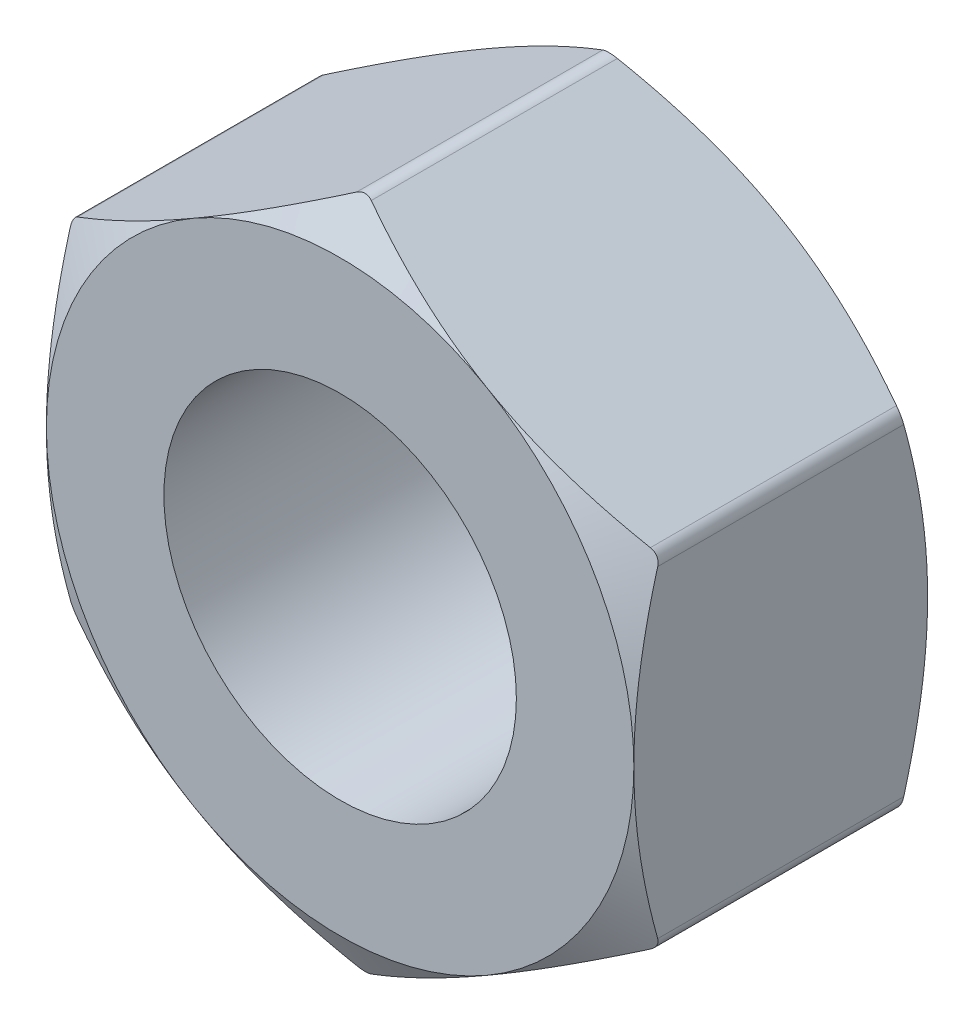
from build123d import *

# Parameters (mm, degrees)
BOSS_EXTRUDE2_DEPTH     = 2.5
CUT_EXTRUDE4_DEPTH      = 9.036375634
CUT_EXTRUDE4_DEPTH_BACK = 9.036375634
SKETCH16_R              = 3
SKETCH7_OUTSIDE_W       = 50.302
SKETCH7_OUTSIDE_H       = 51.85
SKETCH7_OUTSIDE_R       = 5
CUT_EXTRUDE5_DEPTH      = 10.128709292
CUT_EXTRUDE5_DRAFT      = -60
MIRROR4_COPY_1_SKETCH_W = 50.302
MIRROR4_COPY_1_SKETCH_H = 51.85
MIRROR4_COPY_1_SKETCH_R = 5
MIRROR4_COPY_1_DEPTH    = 10.128709292
MIRROR4_COPY_1_DRAFT    = -60
FILLET2_R               = 0.25


with BuildPart() as part:
    # Sketch15 → Boss-Extrude2 (new, symmetric)
    with BuildSketch(Plane.XY):
        Polygon((0, 5.773502692), (-5, 2.886751346), (-5, -2.886751346), (0, -5.773502692), (5, -2.886751346), (5, 2.886751346), align=None)
    extrude(amount=BOSS_EXTRUDE2_DEPTH, both=True)

    # Sketch16 → Cut-Extrude4 (cut, two sides: drawn at the far end of the back side and taken through both)
    with BuildSketch(Plane.XY.offset(-CUT_EXTRUDE4_DEPTH_BACK)):
        Circle(SKETCH16_R)
    extrude(amount=CUT_EXTRUDE4_DEPTH + CUT_EXTRUDE4_DEPTH_BACK, mode=Mode.SUBTRACT)


with BuildPart() as cut_extrude5_tool:
    # Sketch7 outside → Cut-Extrude5 (with draft: the straight prism first)
    with BuildSketch(Plane.XY.offset(2.5)):
        Rectangle(SKETCH7_OUTSIDE_W, SKETCH7_OUTSIDE_H)
        Circle(SKETCH7_OUTSIDE_R, mode=Mode.SUBTRACT)
    extrude(amount=-CUT_EXTRUDE5_DEPTH)
    # Cut-Extrude5: the draft: its side faces are tilted about the plane it starts from
    cut_extrude5_sides = [cut_extrude5_tool.faces().sort_by_distance(p)[0] for p in [
        (0, -25.925, -2.564354646),
        (25.151, 0, -2.564354646),
        (0, 25.925, -2.564354646),
        (-25.151, 0, -2.564354646),
        (-5, 0, -2.564354646),
    ]]
    draft(cut_extrude5_sides, Plane.XY.offset(2.5), CUT_EXTRUDE5_DRAFT)


with BuildPart() as part_1:
    add(part.part)

    # Cut-Extrude5: cut by cut_extrude5_tool
    add(cut_extrude5_tool.part, mode=Mode.SUBTRACT)


with BuildPart() as mirror4_copy_1_tool:
    # Mirror4 copy 1 sketch → Mirror4 copy 1 (with draft: the straight prism first)
    with BuildSketch(Plane(origin=(0, 0, -2.5), x_dir=(1, 0, 0), z_dir=(0, 0, -1))):
        Rectangle(MIRROR4_COPY_1_SKETCH_W, MIRROR4_COPY_1_SKETCH_H)
        Circle(MIRROR4_COPY_1_SKETCH_R, mode=Mode.SUBTRACT)
    extrude(amount=-MIRROR4_COPY_1_DEPTH)
    # Mirror4 copy 1: the draft: its side faces are tilted about the plane it starts from
    mirror4_copy_1_sides = [mirror4_copy_1_tool.faces().sort_by_distance(p)[0] for p in [
        (0, -25.925, 2.564354646),
        (25.151, 0, 2.564354646),
        (0, 25.925, 2.564354646),
        (-25.151, 0, 2.564354646),
        (-5, 0, 2.564354646),
    ]]
    draft(mirror4_copy_1_sides, Plane(origin=(0, 0, -2.5), x_dir=(1, 0, 0), z_dir=(0, 0, -1)), MIRROR4_COPY_1_DRAFT)


with BuildPart() as part_2:
    add(part_1.part)

    # Mirror4 copy 1: cut by mirror4_copy_1_tool
    add(mirror4_copy_1_tool.part, mode=Mode.SUBTRACT)

    # Fillet2
    fillet2_edges = [part_2.edges().sort_by_distance(p)[0] for p in [
        (-5, 2.886751346, 0),
        (-5, -2.886751346, 0),
        (0, -5.773502692, 0),
        (5, -2.886751346, 0),
        (5, 2.886751346, 0),
        (0, 5.773502692, 0),
    ]]
    fillet(fillet2_edges, radius=FILLET2_R)


solid = part_2.part
